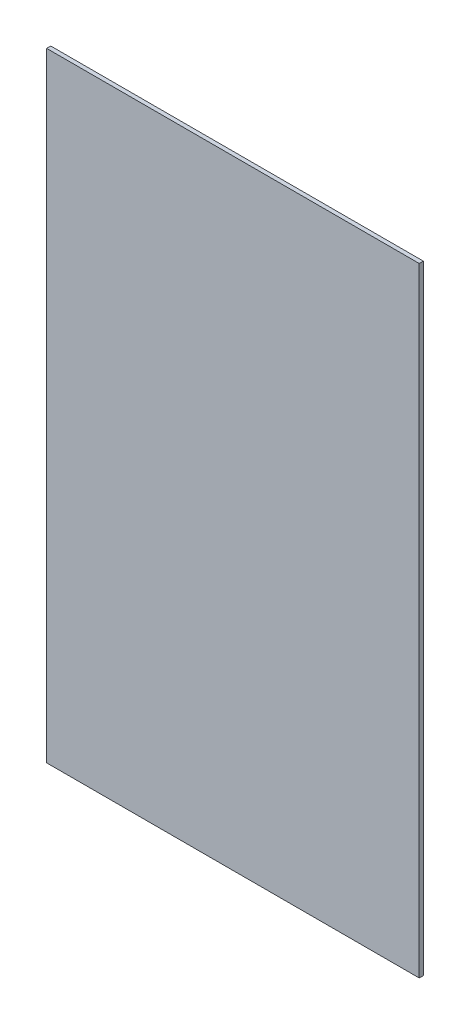
from build123d import *

# Parameters (mm, degrees)
SKETCH_1_W      = 454
SKETCH_1_H      = 754
EXTRUDE_1_DEPTH = 5


with BuildPart() as part:
    # 草图1 → 凸台-拉伸1 (new body)
    with BuildSketch(Plane.XY):
        Rectangle(SKETCH_1_W, SKETCH_1_H)
    extrude(amount=EXTRUDE_1_DEPTH)


solid = part.part
